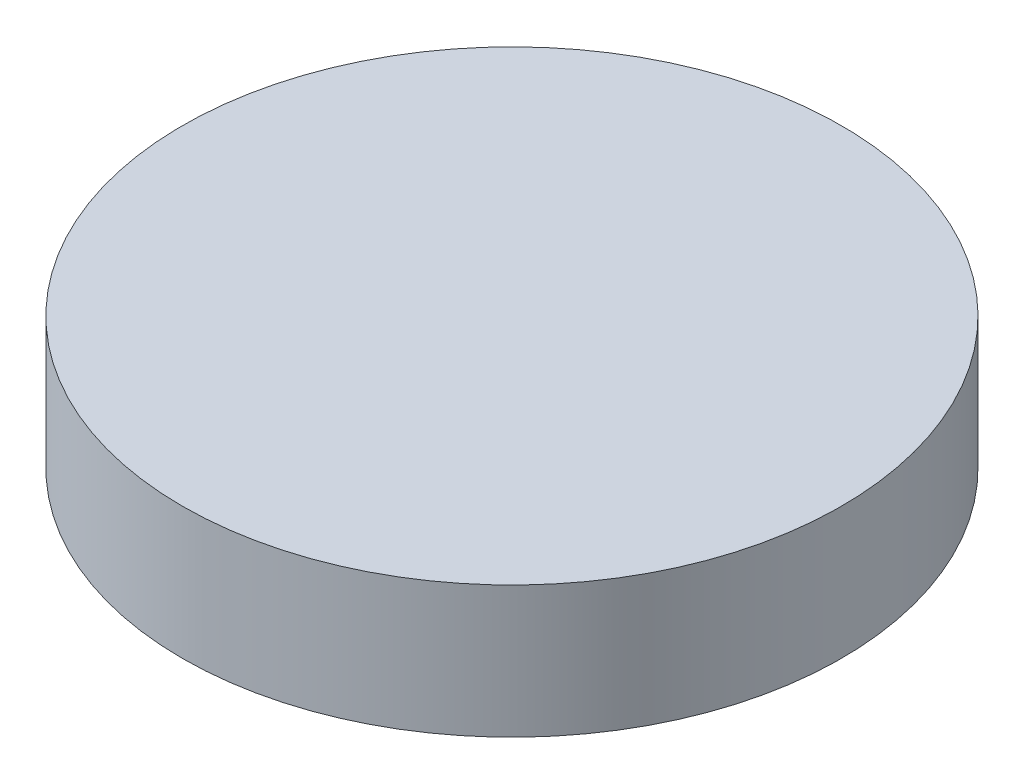
from build123d import *

# Parameters (mm, degrees)
SKETCH1_R           = 10
BOSS_EXTRUDE1_DEPTH = 4


with BuildPart() as part:
    # Sketch1 → Boss-Extrude1 (new body)
    with BuildSketch(Plane(origin=(0, 0, 0), x_dir=(1, 0, 0), z_dir=(0, 1, 0))):
        with Locations(Location((0, 0, 0), (0, 0, 270))):
            Circle(SKETCH1_R)
    extrude(amount=BOSS_EXTRUDE1_DEPTH)


solid = part.part
